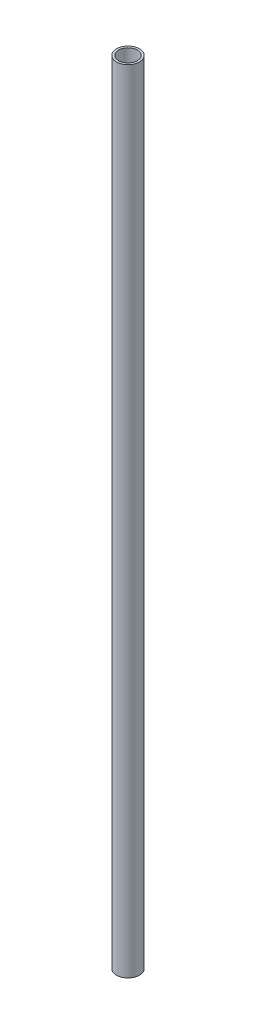
from build123d import *

# Parameters (mm, degrees)
SKETCH1_R           = 4.825
SKETCH1_R_2         = 3.925
BOSS_EXTRUDE1_DEPTH = 333


with BuildPart() as part:
    # Sketch1 → Boss-Extrude1 (new body)
    with BuildSketch(Plane(origin=(0, 0, 0), x_dir=(1, 0, 0), z_dir=(0, 1, 0))):
        with Locations(Location((0, 0, 0), (0, 0, 270))):
            Circle(SKETCH1_R)
        with Locations(Location((0, 0, 0), (0, 0, 270))):
            Circle(SKETCH1_R_2, mode=Mode.SUBTRACT)
    extrude(amount=BOSS_EXTRUDE1_DEPTH)


solid = part.part
